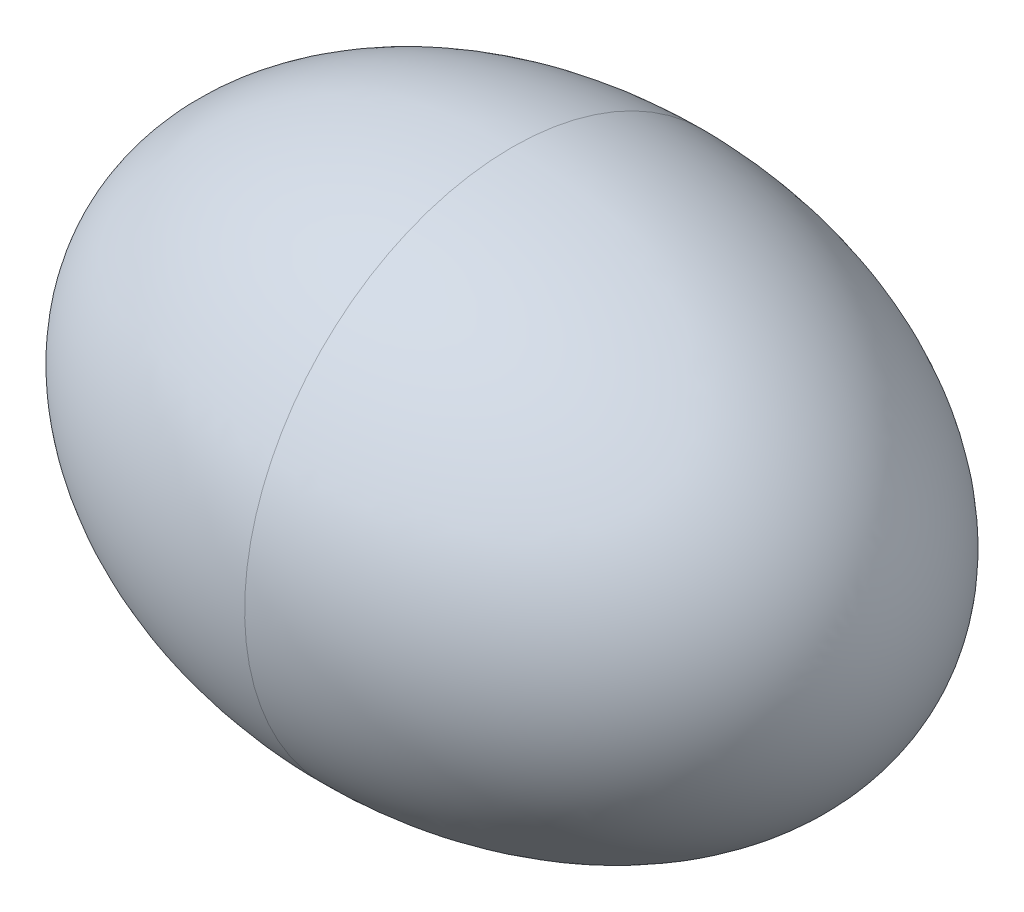
from build123d import *


with BuildPart() as part:
    # Sketch1 → Revolve1 (revolve)
    with BuildSketch(Plane.XY):
        with BuildLine():
            Line((31.75, 0), (-31.75, 0))
            add(Edge.make_bspline(
                [(0, 22.23394555), (-0.143762843, 22.23394555), (-0.432206158, 22.232542441), (-0.910783322, 22.226228355), (-1.548896024, 22.209387558), (-2.317972602, 22.177800701), (-3.238981396, 22.123019234), (-4.319993914, 22.034436887), (-5.54664921, 21.899206566), (-7.07766942, 21.687410825), (-8.598498447, 21.418159929), (-10.108750769, 21.090651254), (-11.903261161, 20.626441442), (-13.678194871, 20.090063329), (-15.42308502, 19.46145641), (-17.130225135, 18.737413175), (-18.801312296, 17.934833955), (-20.432219209, 17.052201547), (-22.010385776, 16.062674053), (-23.51489457, 14.965308784), (-24.711596518, 13.976417446), (-25.631207002, 13.139496207), (-26.502825554, 12.262909571), (-27.327217604, 11.341700533), (-28.099347313, 10.376175404), (-28.813792855, 9.367146335), (-29.464827321, 8.315977253), (-30.046494258, 7.224835718), (-30.552787597, 6.096641183), (-30.977901101, 4.93531335), (-31.343391494, 3.650668598), (-31.613842491, 2.267424937), (-31.724147646, 1.171980021), (-31.749992916, 0.382451312), (-31.75, 0)],
                knots=[0.069219131, 0.069219131, 0.069219131, 0.069219131, 0.069219131, 0.082677268, 0.096135404, 0.109593541, 0.123051678, 0.14996795, 0.176884222, 0.203800495, 0.230716767, 0.284549308, 0.311465586, 0.338381864, 0.392214401, 0.44604693, 0.472963204, 0.499879477, 0.553711987, 0.607544507, 0.635097733, 0.662014085, 0.688930457, 0.715846566, 0.742762861, 0.769678545, 0.796594934, 0.823510315, 0.850426801, 0.877341102, 0.904254958, 0.931177171, 0.966689047, 1, 1, 1, 1, 1], degree=4))
            add(Edge.make_bspline(
                [(0, 22.23394555), (0.143762843, 22.23394555), (0.432206158, 22.232542441), (0.910783322, 22.226228355), (1.548896024, 22.209387558), (2.317972602, 22.177800701), (3.238981396, 22.123019234), (4.319993914, 22.034436887), (5.54664921, 21.899206566), (7.07766942, 21.687410825), (8.598498447, 21.418159929), (10.108750769, 21.090651254), (11.903261161, 20.626441442), (13.678194871, 20.090063329), (15.42308502, 19.46145641), (17.130225135, 18.737413175), (18.801312296, 17.934833955), (20.432219209, 17.052201547), (22.010385776, 16.062674053), (23.51489457, 14.965308784), (24.711596518, 13.976417446), (25.631207002, 13.139496207), (26.502825554, 12.262909571), (27.327217604, 11.341700533), (28.099347313, 10.376175404), (28.813792855, 9.367146335), (29.464827321, 8.315977253), (30.046494258, 7.224835718), (30.552787597, 6.096641183), (30.977901101, 4.93531335), (31.343391494, 3.650668598), (31.613842491, 2.267424937), (31.724147646, 1.171980021), (31.749992916, 0.382451312), (31.75, 0)],
                knots=[0.069219131, 0.069219131, 0.069219131, 0.069219131, 0.069219131, 0.082677268, 0.096135404, 0.109593541, 0.123051678, 0.14996795, 0.176884222, 0.203800495, 0.230716767, 0.284549308, 0.311465586, 0.338381864, 0.392214401, 0.44604693, 0.472963204, 0.499879477, 0.553711987, 0.607544507, 0.635097733, 0.662014085, 0.688930457, 0.715846566, 0.742762861, 0.769678545, 0.796594934, 0.823510315, 0.850426801, 0.877341102, 0.904254958, 0.931177171, 0.966689047, 1, 1, 1, 1, 1], degree=4))
        make_face()
    revolve(axis=Axis((31.75, 0, 0), (-1, 0, 0)))


solid = part.part
